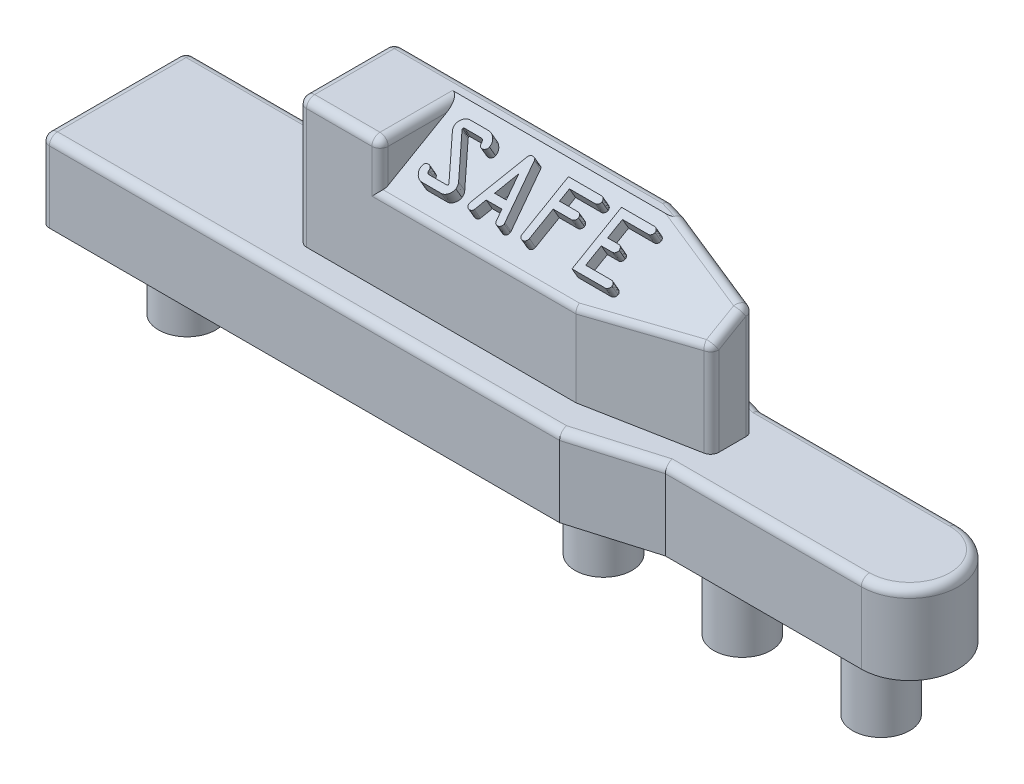
from build123d import *

# Parameters (mm, degrees)
SKETCH1_W           = 104
SKETCH1_H           = 9.72
BODY_DEPTH          = 17.75
FRONT_CUT_OUT_DEPTH = 89.865925518
SKETCH4_R           = 3.5
BOSS_EXTRUDE2_DEPTH = 9.5
BOLT_STOPPER_DEPTH  = 15.7
FILLET3_R           = 1
FILLET4_R           = 1
FILLET5_R           = 1
SKETCH10_W          = 45.585337272
SKETCH10_H          = 21.305143548
CUT_EXTRUDE1_DEPTH  = 92.92115186
SAFE_TEXT_DEPTH     = 1.5
FILLET8_R           = 1


with BuildPart() as part:
    # Sketch1 → body (new body)
    with BuildSketch(Plane.XY):
        with Locations((34.530987618, 4.261078665)):
            Rectangle(SKETCH1_W, SKETCH1_H)
    extrude(amount=BODY_DEPTH)

    # Sketch2 → front_cut_out (cut, through all)
    with BuildSketch(Plane.XZ.offset(0.598921335)):
        with BuildLine():
            Line((46.030987618, 17.75), (56.030987618, 14.8))
            Line((56.030987618, 14.8), (80.030987618, 14.8))
            ThreePointArc((80.030987618, 14.8), (85.955987618, 8.875), (80.030987618, 2.95))
            Line((80.030987618, 2.95), (56.030987618, 2.95))
            Line((56.030987618, 2.95), (46.030987618, 0))
            Line((46.030987618, 0), (86.530987618, 0))
            Line((86.530987618, 0), (86.530987618, 17.75))
            Line((86.530987618, 17.75), (46.030987618, 17.75))
        make_face()
    extrude(amount=-FRONT_CUT_OUT_DEPTH, mode=Mode.SUBTRACT)

    # Sketch4 → Boss-Extrude2 (add)
    with BuildSketch(Plane.XZ.offset(0.598921335)):
        with Locations((-8.469012382, 8.875)):
            Circle(SKETCH4_R)
        with Locations((42.530987618, 8.875)):
            Circle(SKETCH4_R)
        with Locations((59.530987618, 8.875)):
            Circle(SKETCH4_R)
        with Locations((76.530987618, 8.875)):
            Circle(SKETCH4_R)
    extrude(amount=BOSS_EXTRUDE2_DEPTH)

    # Sketch6 → bolt_stopper (add)
    with BuildSketch(Plane(origin=(0, 9.121078665, 0), x_dir=(1, 0, 0), z_dir=(0, 1, 0))):
        Polygon((10.030987618, -2), (10.030987618, -13.75), (44.030987618, -13.75), (58.030987618, -11.090630326), (58.030987618, -6.2), (44.030987618, -2), align=None)
    extrude(amount=BOLT_STOPPER_DEPTH)

    # Fillet3
    fillet3_edges = [part.edges().sort_by_distance(p)[0] for p in [
        (-17.469012382, 4.261078665, 0),
        (-17.469012382, 4.261078665, 17.75),
    ]]
    fillet(fillet3_edges, radius=FILLET3_R)

    # Fillet4
    fillet4_edges = [part.edges().sort_by_distance(p)[0] for p in [
        (-17.176119163, 9.121078665, 17.457106781),
        (-17.176119163, 9.121078665, 0.292893219),
        (51.030987618, 9.121078665, 1.475),
        (14.780987618, 9.121078665, 0),
        (68.030987618, 9.121078665, 2.95),
        (85.955987618, 9.121078665, 8.875),
        (51.030987618, 9.121078665, 16.275),
        (68.030987618, 9.121078665, 14.8),
        (14.780987618, 9.121078665, 17.75),
        (-17.469012382, 9.121078665, 8.875),
    ]]
    fillet(fillet4_edges, radius=FILLET4_R)

    # Fillet5
    fillet5_edges = [part.edges().sort_by_distance(p)[0] for p in [
        (58.030987618, 24.821078665, 8.645315163),
    ]]
    fillet(fillet5_edges, radius=FILLET5_R)

    # Sketch10 → Cut-Extrude1 (cut, through all)
    with BuildSketch(Plane(origin=(0, 20.29473365, 11.717169936), x_dir=(-1, 0, 0), z_dir=(0, -0.8660254037844416, -0.49999999999999495))):
        with Locations((-42.823656254, 4.646602684)):
            Rectangle(SKETCH10_W, SKETCH10_H)
    extrude(amount=-CUT_EXTRUDE1_DEPTH, mode=Mode.SUBTRACT)

    # Sketch12 → safe_text (add)
    # profile 1 of 4: a face of its own
    with BuildSketch(Plane(origin=(0, 20.29473365, 11.717169936), x_dir=(1, 0, 0), z_dir=(0, 0.8660254037844417, 0.49999999999999495))):
        with BuildLine():
            Line((23.618487618, 7.152690031), (25.877862618, 7.152690031))
            add(Edge.make_bspline(
                [(25.877862618, 7.152690031), (25.946704199, 7.148725948), (26.085777368, 7.140717744), (26.287810504, 7.065862946), (26.483859416, 6.951098131), (26.633832598, 6.819441373), (26.749400904, 6.700571245), (26.823954098, 6.601879351), (26.887401032, 6.498609667), (26.940463079, 6.391674339), (26.982067188, 6.279200978), (27.009366325, 6.161539573), (27.027234865, 6.039169368), (27.029724621, 5.955878902), (27.030987618, 5.913627531)],
                knots=[0, 0, 0, 0, 1.325667008, 2.678101067, 4.112216635, 5.696956481, 6.515473443, 7.312430205, 8.080401666, 8.854414035, 9.615232794, 10.391335327, 11.18396077, 12, 12, 12, 12], degree=3))
            add(Edge.make_bspline(
                [(27.030987618, 5.913627531), (27.029081371, 5.882729332), (27.025324709, 5.821837904), (26.998409387, 5.733518555), (26.949786252, 5.654355505), (26.885502472, 5.585395927), (26.813022721, 5.526223235), (26.732150482, 5.485518459), (26.648640329, 5.456135763), (26.590095072, 5.453842456), (26.560675118, 5.452690031)],
                knots=[0, 0, 0, 0, 1.019154878, 2.008459994, 3.010519384, 4.0567001, 5.108792284, 6.077280298, 7.03380174, 8, 8, 8, 8], degree=3))
            add(Edge.make_bspline(
                [(26.560675118, 5.452690031), (26.522553946, 5.453526644), (26.452421314, 5.455065786), (26.356175407, 5.474837654), (26.27879218, 5.508956849), (26.216981957, 5.559078008), (26.173283906, 5.631339868), (26.131506449, 5.720278519), (26.092772151, 5.832710513), (26.0605629, 5.959593319), (26.022049222, 6.084769893), (25.950366801, 6.183101696), (25.851355408, 6.242928443), (25.777086598, 6.249369557), (25.738800118, 6.252690031)],
                knots=[0, 0, 0, 0, 1.077804252, 1.982867868, 2.761285067, 3.452132591, 4.19629161, 5.126110633, 6.235807406, 7.55209165, 8.839325589, 9.912583189, 10.923911114, 12, 12, 12, 12], degree=3))
            Line((25.738800118, 6.252690031), (23.679425118, 6.252690031))
            add(Edge.make_bspline(
                [(23.679425118, 6.252690031), (23.657382575, 6.251922705), (23.618942826, 6.250584574), (23.5681558, 6.232223321), (23.535375422, 6.195643058), (23.532483138, 6.165270064), (23.530987618, 6.149565031)],
                knots=[0, 0, 0, 0, 1.28974637, 2.249174457, 3.094696687, 4, 4, 4, 4], degree=3))
            add(Edge.make_bspline(
                [(23.530987618, 6.149565031), (23.533455504, 6.126003093), (23.539216884, 6.070996782), (23.572753756, 6.026540804), (23.591925118, 6.001127531)],
                knots=[0, 0, 0, 0, 0.85669941, 2, 2, 2, 2], degree=3))
            Line((23.591925118, 6.001127531), (26.799737618, 1.815190031))
            add(Edge.make_bspline(
                [(26.799737618, 1.815190031), (26.835468419, 1.764717833), (26.905232571, 1.666171201), (26.976637444, 1.502054941), (27.023512659, 1.33291144), (27.028490274, 1.217062958), (27.030987618, 1.158940031)],
                knots=[0, 0, 0, 0, 1.045281937, 2.04090609, 3.017093082, 4, 4, 4, 4], degree=3))
            add(Edge.make_bspline(
                [(27.030987618, 1.158940031), (27.027994807, 1.093945337), (27.022095896, 0.965839084), (26.965431394, 0.78094139), (26.877156467, 0.607553281), (26.754126494, 0.453317402), (26.613031583, 0.321985717), (26.457395077, 0.224959638), (26.292776488, 0.163244406), (26.178367607, 0.15618968), (26.121612618, 0.152690031)],
                knots=[0, 0, 0, 0, 1.042564233, 2.054921576, 3.081212753, 4.15509417, 5.210263583, 6.165478205, 7.089945969, 8, 8, 8, 8], degree=3))
            Line((26.121612618, 0.152690031), (23.782550118, 0.152690031))
            add(Edge.make_bspline(
                [(23.782550118, 0.152690031), (23.744458221, 0.153968688), (23.668932194, 0.156503922), (23.558001001, 0.174364695), (23.44990622, 0.201708888), (23.347687529, 0.245208267), (23.24745227, 0.29656827), (23.152464541, 0.361677573), (23.059436053, 0.436408756), (22.945879901, 0.551852523), (22.82180999, 0.707090068), (22.711827735, 0.909245139), (22.643586279, 1.122335206), (22.635202371, 1.268348722), (22.630987618, 1.341752531)],
                knots=[0, 0, 0, 0, 0.751762141, 1.490542934, 2.21384789, 2.947097895, 3.678398628, 4.434158599, 5.21625138, 6.030598605, 7.626900823, 9.122139219, 10.553243913, 12, 12, 12, 12], degree=3))
            add(Edge.make_bspline(
                [(22.630987618, 1.341752531), (22.632363556, 1.381984388), (22.634942576, 1.457393894), (22.65696506, 1.562458993), (22.692182034, 1.652757439), (22.745144686, 1.725832033), (22.811449615, 1.785317702), (22.894264371, 1.82519122), (22.991123649, 1.849029229), (23.060000742, 1.851419482), (23.096612618, 1.852690031)],
                knots=[0, 0, 0, 0, 1.218733515, 2.28436113, 3.240544814, 4.134711234, 4.996485967, 5.914739673, 6.89157208, 8, 8, 8, 8], degree=3))
            add(Edge.make_bspline(
                [(23.096612618, 1.852690031), (23.12547344, 1.851452795), (23.182924127, 1.848989938), (23.264453186, 1.821198638), (23.33907481, 1.77721139), (23.404696753, 1.718297461), (23.460793704, 1.648930997), (23.502200508, 1.571706217), (23.526886892, 1.487511302), (23.529595581, 1.429419367), (23.530987618, 1.399565031)],
                knots=[0, 0, 0, 0, 0.992626683, 1.975934257, 2.93462197, 3.966033284, 5.001820302, 5.998830898, 6.971568516, 8, 8, 8, 8], degree=3))
            add(Edge.make_bspline(
                [(23.530987618, 1.399565031), (23.532191105, 1.375494845), (23.534501023, 1.329295587), (23.552303712, 1.262777611), (23.5824499, 1.202979533), (23.623105067, 1.149941025), (23.672597444, 1.104975983), (23.731647132, 1.076584765), (23.794677718, 1.0555604), (23.839128875, 1.053671835), (23.862237618, 1.052690031)],
                knots=[0, 0, 0, 0, 1.076902211, 2.066958898, 3.057839374, 4.056103359, 5.04780694, 6.01788285, 6.969560318, 8, 8, 8, 8], degree=3))
            Line((23.862237618, 1.052690031), (25.993487618, 1.052690031))
            add(Edge.make_bspline(
                [(25.993487618, 1.052690031), (26.014020912, 1.053949017), (26.050203402, 1.056167525), (26.098415961, 1.077005345), (26.128199238, 1.116805336), (26.130029686, 1.148567739), (26.130987618, 1.165190031)],
                knots=[0, 0, 0, 0, 1.216491943, 2.143626269, 3.028499676, 4, 4, 4, 4], degree=3))
            add(Edge.make_bspline(
                [(26.130987618, 1.165190031), (26.127662949, 1.186083007), (26.119477035, 1.237525147), (26.086505453, 1.278410228), (26.066925118, 1.302690031)],
                knots=[0, 0, 0, 0, 0.812290305, 2, 2, 2, 2], degree=3))
            Line((26.066925118, 1.302690031), (22.857550118, 5.490190031))
            add(Edge.make_bspline(
                [(22.857550118, 5.490190031), (22.823148653, 5.540293261), (22.755707101, 5.638516973), (22.682852233, 5.800247276), (22.63916389, 5.969133247), (22.633713154, 6.084210407), (22.630987618, 6.141752531)],
                knots=[0, 0, 0, 0, 1.037618896, 2.034175822, 3.017027384, 4, 4, 4, 4], degree=3))
            add(Edge.make_bspline(
                [(22.630987618, 6.141752531), (22.634740743, 6.207719377), (22.642135218, 6.337688459), (22.69666448, 6.52605701), (22.790251854, 6.6992239), (22.91537874, 6.855349434), (23.067148299, 6.985544616), (23.236543636, 7.083688593), (23.423027161, 7.142583249), (23.552444951, 7.149275126), (23.618487618, 7.152690031)],
                knots=[0, 0, 0, 0, 1.009957737, 1.98983711, 2.975062645, 4.008144808, 5.038078922, 6.020877988, 6.990042263, 8, 8, 8, 8], degree=3))
        make_face()
    # profile 2 of 4: a face of its own
    with BuildSketch(Plane(origin=(0, 20.29473365, 11.717169936), x_dir=(1, 0, 0), z_dir=(0, 0.8660254037844417, 0.49999999999999495))):
        with BuildLine():
            Line((29.155987618, 0.769877531), (30.845050118, 6.827690031))
            add(Edge.make_bspline(
                [(30.845050118, 6.827690031), (30.854101019, 6.853591947), (30.871482743, 6.903335056), (30.910291806, 6.969434158), (30.95353646, 7.027187258), (31.006646428, 7.073127714), (31.066185322, 7.109561383), (31.133631219, 7.134423872), (31.207807611, 7.150761141), (31.260059239, 7.152030027), (31.287237618, 7.152690031)],
                knots=[0, 0, 0, 0, 1.106507284, 2.124982273, 3.085209702, 4.010165746, 4.945368943, 5.891645595, 6.903351783, 8, 8, 8, 8], degree=3))
            add(Edge.make_bspline(
                [(31.287237618, 7.152690031), (31.336678559, 7.149885582), (31.429403331, 7.144625935), (31.555788037, 7.092530762), (31.648162684, 6.997634814), (31.680013386, 6.917756641), (31.696612618, 6.876127531)],
                knots=[0, 0, 0, 0, 1.108807146, 2.079529432, 2.999132335, 4, 4, 4, 4], degree=3))
            Line((31.696612618, 6.876127531), (33.410675118, 0.727690031))
            add(Edge.make_bspline(
                [(33.410675118, 0.727690031), (33.416797493, 0.70543306), (33.428620949, 0.662450662), (33.430217694, 0.617914606), (33.430987618, 0.596440031)],
                knots=[0, 0, 0, 0, 1.035631882, 2, 2, 2, 2], degree=3))
            add(Edge.make_bspline(
                [(33.430987618, 0.596440031), (33.429569279, 0.566601275), (33.426809408, 0.508539658), (33.40262244, 0.424571014), (33.360502755, 0.349181305), (33.306912867, 0.28065511), (33.241844711, 0.225594088), (33.171597316, 0.183133298), (33.095319998, 0.156706966), (33.042127908, 0.154034678), (33.015362618, 0.152690031)],
                knots=[0, 0, 0, 0, 1.063505387, 2.06941751, 3.084049354, 4.129040484, 5.15720135, 6.107121156, 7.04753787, 8, 8, 8, 8], degree=3))
            add(Edge.make_bspline(
                [(33.015362618, 0.152690031), (32.987656918, 0.153304057), (32.934872195, 0.154473896), (32.859749122, 0.171187972), (32.791968403, 0.195649514), (32.731791453, 0.230634027), (32.678575351, 0.274551827), (32.636900593, 0.331348661), (32.599600989, 0.395851722), (32.583261141, 0.444500413), (32.574737618, 0.469877531)],
                knots=[0, 0, 0, 0, 1.127416482, 2.14794666, 3.122352628, 4.054892479, 4.974034822, 5.912841489, 6.911254017, 8, 8, 8, 8], degree=3))
            Line((32.574737618, 0.469877531), (32.246612618, 1.652690031))
            Line((32.246612618, 1.652690031), (30.316925118, 1.652690031))
            Line((30.316925118, 1.652690031), (29.966925118, 0.379252531))
            add(Edge.make_bspline(
                [(29.966925118, 0.379252531), (29.962953538, 0.365398655), (29.954617918, 0.336321913), (29.925916611, 0.296082517), (29.883920676, 0.259702281), (29.816884444, 0.209855623), (29.714494108, 0.163769637), (29.625780326, 0.156407345), (29.580987618, 0.152690031)],
                knots=[0, 0, 0, 0, 0.543122611, 1.139914679, 1.838391676, 2.643875945, 4.305450646, 6, 6, 6, 6], degree=3))
            add(Edge.make_bspline(
                [(29.580987618, 0.152690031), (29.54953453, 0.153896395), (29.488659193, 0.156231232), (29.402174197, 0.18286307), (29.323712642, 0.224035872), (29.255239721, 0.281490678), (29.201510753, 0.352412036), (29.158958841, 0.429722161), (29.135379677, 0.515927784), (29.132470062, 0.575475556), (29.130987618, 0.605815031)],
                knots=[0, 0, 0, 0, 1.055753381, 2.0433397, 3.016024712, 4.024102876, 5.023757907, 5.996442919, 6.979191541, 8, 8, 8, 8], degree=3))
            add(Edge.make_bspline(
                [(29.130987618, 0.605815031), (29.132112302, 0.633042972), (29.134408852, 0.688641091), (29.148696849, 0.742430359), (29.155987618, 0.769877531)],
                knots=[0, 0, 0, 0, 0.979455461, 2, 2, 2, 2], degree=3))
        make_face()
        Polygon((31.280987618, 5.152690031), (30.565362618, 2.552690031), (31.999737618, 2.552690031), align=None, mode=Mode.SUBTRACT)
    # profile 3 of 4: a face of its own
    with BuildSketch(Plane(origin=(0, 20.29473365, 11.717169936), x_dir=(1, 0, 0), z_dir=(0, 0.8660254037844417, 0.49999999999999495))):
        with BuildLine():
            Line((35.630987618, 0.594877531), (35.630987618, 7.152690031))
            Line((35.630987618, 7.152690031), (39.684112618, 7.152690031))
            add(Edge.make_bspline(
                [(39.684112618, 7.152690031), (39.712410588, 7.151279196), (39.769097787, 7.148452976), (39.8513842, 7.122544981), (39.927558804, 7.078796405), (39.996620969, 7.021662886), (40.056160964, 6.954266361), (40.09871944, 6.877387198), (40.127578665, 6.794818299), (40.129841005, 6.736788531), (40.130987618, 6.707377531)],
                knots=[0, 0, 0, 0, 0.972515176, 1.948166706, 2.9357758, 3.98050755, 5.023082354, 6.010691447, 6.991766502, 8, 8, 8, 8], degree=3))
            add(Edge.make_bspline(
                [(40.130987618, 6.707377531), (40.129694484, 6.677492144), (40.12715017, 6.618690987), (40.100410322, 6.533668756), (40.058122105, 6.454988148), (39.999771745, 6.385691506), (39.93304941, 6.325625261), (39.855205777, 6.285296915), (39.773177527, 6.255989784), (39.715106852, 6.253799914), (39.685675118, 6.252690031)],
                knots=[0, 0, 0, 0, 1.01424512, 1.995583599, 3.002834378, 4.035499497, 5.066032582, 6.033667922, 7.003411579, 8, 8, 8, 8], degree=3))
            Line((39.685675118, 6.252690031), (36.530987618, 6.252690031))
            Line((36.530987618, 6.252690031), (36.530987618, 4.852690031))
            Line((36.530987618, 4.852690031), (38.785675118, 4.852690031))
            add(Edge.make_bspline(
                [(38.785675118, 4.852690031), (38.815557429, 4.851391449), (38.874352534, 4.848836419), (38.958297154, 4.822527358), (39.035558532, 4.780989929), (39.102893815, 4.723474455), (39.159722761, 4.654984158), (39.200487647, 4.577226112), (39.227342749, 4.4924517), (39.229752487, 4.433107428), (39.230987618, 4.402690031)],
                knots=[0, 0, 0, 0, 1.015962941, 1.998963508, 2.968237726, 3.988999178, 4.998424523, 5.983347518, 6.966348085, 8, 8, 8, 8], degree=3))
            add(Edge.make_bspline(
                [(39.230987618, 4.402690031), (39.229752487, 4.372272633), (39.227342749, 4.312928361), (39.200487647, 4.22815395), (39.159722761, 4.150395903), (39.102893815, 4.081905606), (39.035558532, 4.024390132), (38.958297154, 3.982852704), (38.874352534, 3.956543642), (38.815557429, 3.953988612), (38.785675118, 3.952690031)],
                knots=[0, 0, 0, 0, 1.033651915, 2.016652482, 3.001575477, 4.011000822, 5.031762274, 6.001036492, 6.984037059, 8, 8, 8, 8], degree=3))
            Line((38.785675118, 3.952690031), (36.530987618, 3.952690031))
            Line((36.530987618, 3.952690031), (36.530987618, 0.591752531))
            add(Edge.make_bspline(
                [(36.530987618, 0.591752531), (36.529714045, 0.562372765), (36.527208056, 0.504562667), (36.500383821, 0.421922956), (36.459817557, 0.345058699), (36.401121522, 0.279323788), (36.333788463, 0.222011344), (36.255047378, 0.183565965), (36.170814359, 0.156215483), (36.111427067, 0.153884695), (36.080987618, 0.152690031)],
                knots=[0, 0, 0, 0, 1.005363169, 1.978237127, 2.954392289, 3.968779448, 4.985370772, 5.969031165, 6.95901012, 8, 8, 8, 8], degree=3))
            add(Edge.make_bspline(
                [(36.080987618, 0.152690031), (36.050549811, 0.153886086), (35.991165718, 0.156219588), (35.906909647, 0.183550521), (35.828255657, 0.222069757), (35.760281361, 0.279355364), (35.702635166, 0.346513051), (35.661515581, 0.423421199), (35.634626839, 0.506642964), (35.632220902, 0.564976002), (35.630987618, 0.594877531)],
                knots=[0, 0, 0, 0, 1.03691572, 2.023020159, 3.002830764, 4.015443418, 5.039427973, 6.011762721, 6.980829108, 8, 8, 8, 8], degree=3))
        make_face()
    # profile 4 of 4: a face of its own
    with BuildSketch(Plane(origin=(0, 20.29473365, 11.717169936), x_dir=(1, 0, 0), z_dir=(0, 0.8660254037844417, 0.49999999999999495))):
        with BuildLine():
            Line((46.176300118, 6.252690031), (43.030987618, 6.252690031))
            Line((43.030987618, 6.252690031), (43.030987618, 4.152690031))
            Line((43.030987618, 4.152690031), (44.385675118, 4.152690031))
            add(Edge.make_bspline(
                [(44.385675118, 4.152690031), (44.415029526, 4.151374353), (44.472789728, 4.148785515), (44.55603761, 4.122491241), (44.632032581, 4.079201704), (44.699916303, 4.021618716), (44.757499291, 3.953734993), (44.800788829, 3.877740022), (44.827083103, 3.79449214), (44.829671941, 3.736731938), (44.830987618, 3.707377531)],
                knots=[0, 0, 0, 0, 1.007619604, 1.982677078, 2.969684835, 4, 5.030315165, 6.017322922, 6.992380396, 8, 8, 8, 8], degree=3))
            add(Edge.make_bspline(
                [(44.830987618, 3.707377531), (44.829726415, 3.676456914), (44.827265586, 3.616125366), (44.800920465, 3.530063112), (44.759208896, 3.451841003), (44.703478338, 3.381954369), (44.635489199, 3.324444645), (44.558315504, 3.282838276), (44.474347739, 3.256547413), (44.415555813, 3.253989882), (44.385675118, 3.252690031)],
                knots=[0, 0, 0, 0, 1.045006949, 2.038991906, 3.017979009, 4.035041552, 5.049651123, 6.01308376, 6.990160021, 8, 8, 8, 8], degree=3))
            Line((44.385675118, 3.252690031), (43.030987618, 3.252690031))
            Line((43.030987618, 3.252690031), (43.030987618, 1.052690031))
            Line((43.030987618, 1.052690031), (46.185675118, 1.052690031))
            add(Edge.make_bspline(
                [(46.185675118, 1.052690031), (46.215049883, 1.051410765), (46.272850139, 1.048893575), (46.355561911, 1.022151357), (46.432501793, 0.981082604), (46.49979165, 0.923020089), (46.55800759, 0.85509736), (46.600752198, 0.777624519), (46.627252982, 0.692409509), (46.629722068, 0.633093131), (46.630987618, 0.602690031)],
                knots=[0, 0, 0, 0, 1.000137681, 1.967955018, 2.939036503, 3.961701223, 4.984365943, 5.979587354, 6.964420782, 8, 8, 8, 8], degree=3))
            add(Edge.make_bspline(
                [(46.630987618, 0.602690031), (46.629896568, 0.572229305), (46.627762361, 0.512644973), (46.59867713, 0.428107614), (46.556680249, 0.349737182), (46.49646886, 0.282360368), (46.427778128, 0.224240457), (46.348836337, 0.182858905), (46.263894474, 0.156693195), (46.204612923, 0.154031439), (46.174737618, 0.152690031)],
                knots=[0, 0, 0, 0, 1.023051853, 2.001195343, 2.984377596, 4.006070111, 5.029876372, 6.004699019, 6.994455721, 8, 8, 8, 8], degree=3))
            Line((46.174737618, 0.152690031), (42.130987618, 0.152690031))
            Line((42.130987618, 0.152690031), (42.130987618, 7.152690031))
            Line((42.130987618, 7.152690031), (46.174737618, 7.152690031))
            add(Edge.make_bspline(
                [(46.174737618, 7.152690031), (46.204646955, 7.151478911), (46.264148777, 7.149069501), (46.348966357, 7.120806852), (46.427853971, 7.077927918), (46.496584665, 7.01829415), (46.556261894, 6.949565191), (46.598735566, 6.871067889), (46.62758128, 6.786972661), (46.629841764, 6.727931089), (46.630987618, 6.698002531)],
                knots=[0, 0, 0, 0, 1.002961503, 1.99529795, 2.975954864, 4.008352677, 5.04075049, 6.021407404, 6.997038497, 8, 8, 8, 8], degree=3))
            add(Edge.make_bspline(
                [(46.630987618, 6.698002531), (46.629863861, 6.668578115), (46.627646616, 6.610521879), (46.598301786, 6.527714267), (46.556720405, 6.449721979), (46.496455366, 6.382373299), (46.427790776, 6.324205029), (46.349245405, 6.283214229), (46.265008506, 6.2564858), (46.206192866, 6.25396912), (46.176300118, 6.252690031)],
                knots=[0, 0, 0, 0, 0.996580805, 1.966317051, 2.95799907, 3.98852428, 5.021181508, 6.004431651, 6.985762631, 8, 8, 8, 8], degree=3))
        make_face()
    extrude(amount=SAFE_TEXT_DEPTH)

    # Fillet8
    fillet8_edges = [part.edges().sort_by_distance(p)[0] for p in [
        (10.030987618, 16.971078665, 2),
        (10.030987618, 16.971078665, 13.75),
        (10.030987618, 24.821078665, 7.875),
        (15.030987618, 24.821078665, 13.75),
        (20.030987618, 24.821078665, 8.813655198),
        (20.030987618, 21.971078665, 13.75),
        (32.030987618, 19.121078665, 13.75),
        (51.030987618, 19.888772564, 12.420315163),
        (58.030987618, 22.06826983, 8.645315163),
        (58.030987618, 14.888772564, 11.090630326),
        (58.030987618, 16.300575931, 6.2),
        (54.15983828, 24.150575931, 5.038655198),
        (47.15983828, 24.821078665, 2.938655198),
        (27.030987618, 24.821078665, 2),
    ]]
    fillet(fillet8_edges, radius=FILLET8_R)


solid = part.part
